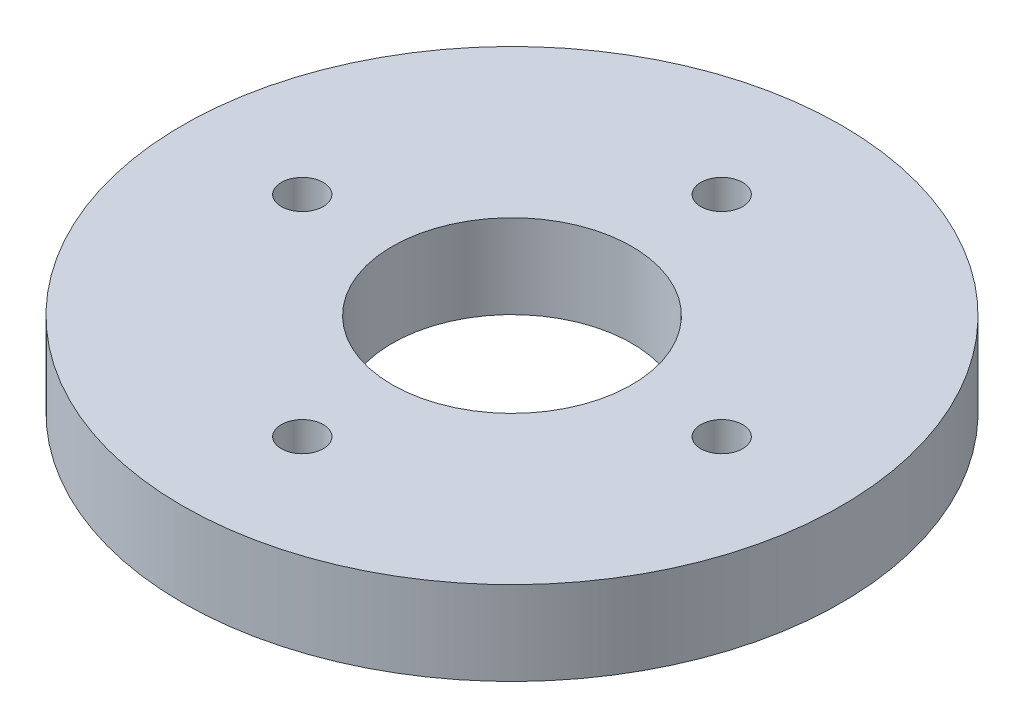
from build123d import *

# Parameters (mm, degrees)
SKETCH_1_R      = 110
SKETCH_1_R_2    = 40
SKETCH_1_R_3    = 7
EXTRUDE_1_DEPTH = 28


with BuildPart() as part:
    # 草图1 → 凸台-拉伸1 (new body)
    with BuildSketch(Plane(origin=(0, 0, 0), x_dir=(1, 0, 0), z_dir=(0, 1, 0))):
        with Locations(Location((0, 0, 0), (0, 0, 270))):
            Circle(SKETCH_1_R)
        with Locations(Location((0, 0, 0), (0, 0, 270))):
            Circle(SKETCH_1_R_2, mode=Mode.SUBTRACT)
        with Locations(Location((70, 0, 0), (0, 0, 270))):
            Circle(SKETCH_1_R_3, mode=Mode.SUBTRACT)
        with Locations(Location((-70, 0, 0), (0, 0, 270))):
            Circle(SKETCH_1_R_3, mode=Mode.SUBTRACT)
        with Locations(Location((0, 70, 0), (0, 0, 270))):
            Circle(SKETCH_1_R_3, mode=Mode.SUBTRACT)
        with Locations(Location((0, -70, 0), (0, 0, 270))):
            Circle(SKETCH_1_R_3, mode=Mode.SUBTRACT)
    extrude(amount=EXTRUDE_1_DEPTH)


solid = part.part
